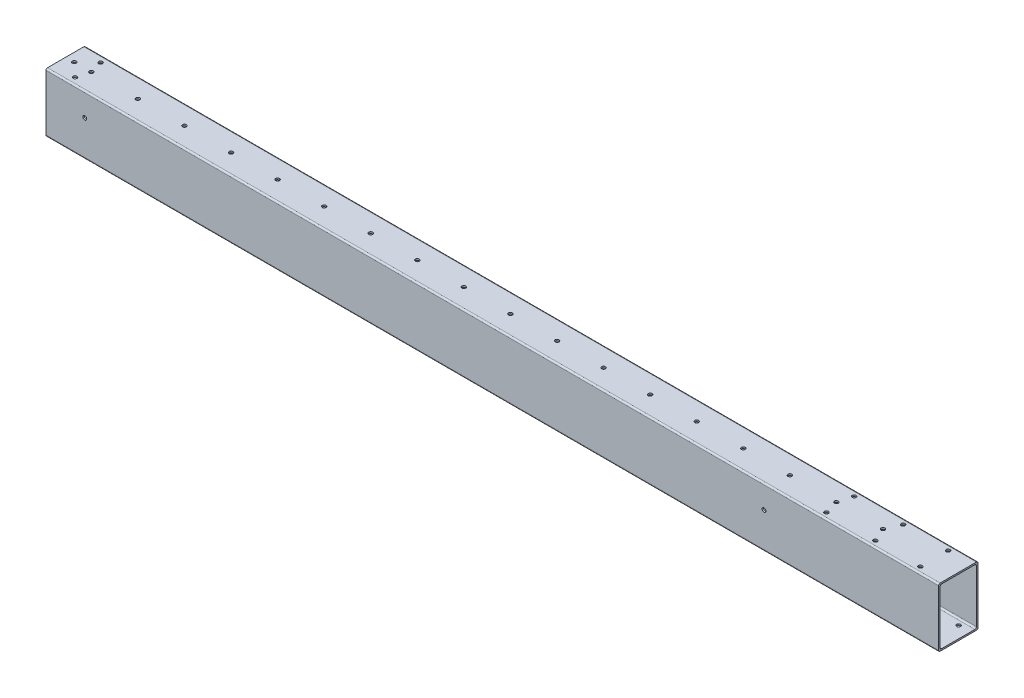
from build123d import *

# Parameters (mm, degrees)
SKETCH1_W             = 50.8
SKETCH1_H             = 76.2
BOSS_EXTRUDE1_DEPTH   = 1150
SKETCH2_W             = 46.8
SKETCH2_H             = 72.2
CUT_EXTRUDE1_DEPTH    = 1151.911278075
FILLET2_R             = 2
CROQUIS1_R            = 2.5
CORTAR_EXTRUIR1_DEPTH = 5
MATRIZL1_COUNT        = 4
MATRIZL1_PITCH        = 357.9333
CROQUIS2_R            = 2.5
CORTAR_EXTRUIR2_DEPTH = 10
CROQUIS3_R            = 2.5
CORTAR_EXTRUIR3_DEPTH = 10
CROQUIS4_R            = 2.5
CORTAR_EXTRUIR4_DEPTH = 10
MATRIZL2_COUNT        = 18
MATRIZL2_PITCH        = 60
CROQUIS5_R            = 2.5
CORTAR_EXTRUIR5_DEPTH = 10


with BuildPart() as part:
    # Sketch1 → Boss-Extrude1 (new body)
    with BuildSketch(Plane(origin=(0, 0, 0), x_dir=(0, 0, -1), z_dir=(1, 0, 0))):
        Rectangle(SKETCH1_W, SKETCH1_H)
    extrude(amount=-BOSS_EXTRUDE1_DEPTH)

    # Sketch2 → Cut-Extrude1 (cut, through all)
    with BuildSketch(Plane(origin=(0, 0, 0), x_dir=(0, 0, -1), z_dir=(1, 0, 0))):
        Rectangle(SKETCH2_W, SKETCH2_H)
    extrude(amount=-CUT_EXTRUDE1_DEPTH, mode=Mode.SUBTRACT)

    # Fillet2
    fillet2_edges = [part.edges().sort_by_distance(p)[0] for p in [
        (-575, -36.1, 23.4),
        (-575, 36.1, 23.4),
        (-575, 36.1, -23.4),
        (-575, -36.1, -23.4),
        (-575, 38.1, 25.4),
        (-575, 38.1, -25.4),
        (-575, -38.1, -25.4),
        (-575, -38.1, 25.4),
    ]]
    fillet(fillet2_edges, radius=FILLET2_R)

    # Croquis1 → Cortar-Extruir1 (cut)
    with BuildSketch(Plane.XZ.offset(38.1)):
        with Locations(Location((-38.1, 0, 0), (0, 0, 270))):
            Circle(CROQUIS1_R)
        with Locations(Location((-61.2, 15.4, 0), (0, 0, 270))):
            Circle(CROQUIS1_R)
        with Locations(Location((-15, 15.4, 0), (0, 0, 270))):
            Circle(CROQUIS1_R)
        with Locations(Location((-15, -15.4, 0), (0, 0, 270))):
            Circle(CROQUIS1_R)
        with Locations(Location((-61.2, -15.4, 0), (0, 0, 270))):
            Circle(CROQUIS1_R)
    cortar_extruir1 = extrude(amount=-CORTAR_EXTRUIR1_DEPTH, mode=Mode.SUBTRACT)

    # MatrizL1: Cortar-Extruir1 ×4
    with Locations(*[(-i * MATRIZL1_PITCH, 0, 0) for i in range(1, MATRIZL1_COUNT)]):
        add(cortar_extruir1, mode=Mode.SUBTRACT)

    # Croquis2 → Cortar-Extruir2 (cut)
    with BuildSketch(Plane.XY.offset(25.4)):
        with Locations((-225, 8.1)):
            Circle(CROQUIS2_R)
        with Locations((-1100, 8.1)):
            Circle(CROQUIS2_R)
    extrude(amount=-CORTAR_EXTRUIR2_DEPTH, mode=Mode.SUBTRACT)

    # Croquis3 → Cortar-Extruir3 (cut)
    with BuildSketch(Plane(origin=(0, 38.1, 0), x_dir=(1, 0, 0), z_dir=(0, 1, 0))):
        with Locations(Location((-152, 17.9, 0), (0, 0, 270))):
            Circle(CROQUIS3_R)
        with Locations(Location((-152, -17.9, 0), (0, 0, 270))):
            Circle(CROQUIS3_R)
        with Locations(Location((-89, -17.9, 0), (0, 0, 270))):
            Circle(CROQUIS3_R)
        with Locations(Location((-89, 17.9, 0), (0, 0, 270))):
            Circle(CROQUIS3_R)
        with Locations(Location((-31, 17.9, 0), (0, 0, 270))):
            Circle(CROQUIS3_R)
        with Locations(Location((-31, -17.9, 0), (0, 0, 270))):
            Circle(CROQUIS3_R)
    extrude(amount=-CORTAR_EXTRUIR3_DEPTH, mode=Mode.SUBTRACT)

    # Croquis4 → Cortar-Extruir4 (cut)
    with BuildSketch(Plane(origin=(0, 38.1, 0), x_dir=(1, 0, 0), z_dir=(0, 1, 0))):
        with Locations(Location((-1117, 0, 0), (0, 0, 270))):
            Circle(CROQUIS4_R)
    cortar_extruir4 = extrude(amount=-CORTAR_EXTRUIR4_DEPTH, mode=Mode.SUBTRACT)

    # MatrizL2: Cortar-Extruir4 ×18
    with Locations(*[(i * MATRIZL2_PITCH, 0, 0) for i in range(1, MATRIZL2_COUNT)]):
        add(cortar_extruir4, mode=Mode.SUBTRACT)

    # Croquis5 → Cortar-Extruir5 (cut)
    with BuildSketch(Plane(origin=(0, 38.1, 0), x_dir=(1, 0, 0), z_dir=(0, 1, 0))):
        with Locations(Location((-1121.5, 16.4, 0), (0, 0, 270))):
            Circle(CROQUIS5_R)
        with Locations(Location((-1121.5, -16.4, 0), (0, 0, 270))):
            Circle(CROQUIS5_R)
        with Locations(Location((-1139, 0, 0), (0, 0, 270))):
            Circle(CROQUIS5_R)
    extrude(amount=-CORTAR_EXTRUIR5_DEPTH, mode=Mode.SUBTRACT)


solid = part.part
